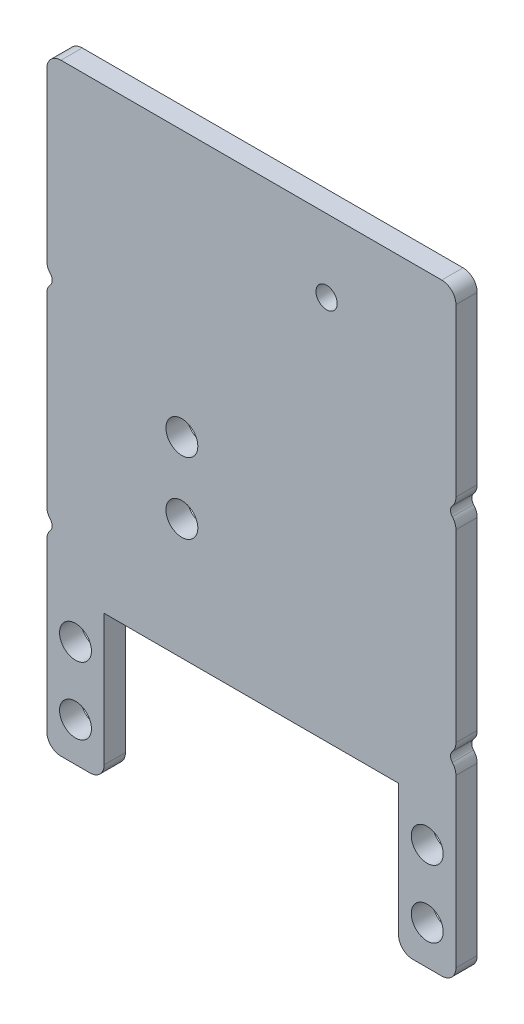
from build123d import *

# Parameters (mm, degrees)
SKETCH1_R           = 2.25
SKETCH1_R_2         = 1.5
BOSS_EXTRUDE1_DEPTH = 3


with BuildPart() as part:
    # Sketch1 → Boss-Extrude1 (new body)
    with BuildSketch(Plane.XY):
        with BuildLine():
            Line((-43.5, -20.5), (-47.6, -20.5))
            ThreePointArc((-47.6, -20.5), (-49.014213562, -19.914213562), (-49.6, -18.5))
            Line((-49.6, -18.5), (-49.6, 5))
            ThreePointArc((-49.6, 5), (-49.468344718, 5.71364418), (-49.090711985, 6.333333333))
            ThreePointArc((-49.090711985, 6.333333333), (-48.836067978, 7), (-49.090711985, 7.666666667))
            ThreePointArc((-49.090711985, 7.666666667), (-49.468344718, 8.28635582), (-49.6, 9))
            Line((-49.6, 9), (-49.6, 35))
            ThreePointArc((-49.6, 35), (-49.468344718, 35.71364418), (-49.090711985, 36.333333333))
            ThreePointArc((-49.090711985, 36.333333333), (-48.836067978, 37), (-49.090711985, 37.666666667))
            ThreePointArc((-49.090711985, 37.666666667), (-49.468344718, 38.28635582), (-49.6, 39))
            Line((-49.6, 39), (-49.6, 62.5))
            ThreePointArc((-49.6, 62.5), (-49.014213562, 63.914213562), (-47.6, 64.5))
            Line((-47.6, 64.5), (6.1, 64.5))
            ThreePointArc((6.1, 64.5), (7.514213562, 63.914213562), (8.1, 62.5))
            Line((8.1, 62.5), (8.1, 39))
            ThreePointArc((8.1, 39), (7.968344718, 38.28635582), (7.590711985, 37.666666667))
            ThreePointArc((7.590711985, 37.666666667), (7.336067978, 37), (7.590711985, 36.333333333))
            ThreePointArc((7.590711985, 36.333333333), (7.968344718, 35.71364418), (8.1, 35))
            Line((8.1, 35), (8.1, 9))
            ThreePointArc((8.1, 9), (7.968344718, 8.28635582), (7.590711985, 7.666666667))
            ThreePointArc((7.590711985, 7.666666667), (7.336067978, 7), (7.590711985, 6.333333333))
            ThreePointArc((7.590711985, 6.333333333), (7.968344718, 5.71364418), (8.1, 5))
            Line((8.1, 5), (8.1, -18.5))
            ThreePointArc((8.1, -18.5), (7.514213562, -19.914213562), (6.1, -20.5))
            Line((6.1, -20.5), (2, -20.5))
            ThreePointArc((2, -20.5), (0.585786438, -19.914213562), (0, -18.5))
            Line((0, -18.5), (0, 0))
            Line((0, 0), (-41.5, 0))
            Line((-41.5, 0), (-41.5, -18.5))
            ThreePointArc((-41.5, -18.5), (-42.085786438, -19.914213562), (-43.5, -20.5))
        make_face()
        with Locations((-45.55, -5.5)):
            Circle(SKETCH1_R, mode=Mode.SUBTRACT)
        with Locations((-45.55, -15)):
            Circle(SKETCH1_R, mode=Mode.SUBTRACT)
        with Locations((4.05, -5.5)):
            Circle(SKETCH1_R, mode=Mode.SUBTRACT)
        with Locations((4.05, -15)):
            Circle(SKETCH1_R, mode=Mode.SUBTRACT)
        with Locations((-30.55, 17)):
            Circle(SKETCH1_R, mode=Mode.SUBTRACT)
        with Locations((-30.55, 27)):
            Circle(SKETCH1_R, mode=Mode.SUBTRACT)
        with Locations((-10.14, 54.25)):
            Circle(SKETCH1_R_2, mode=Mode.SUBTRACT)
    extrude(amount=BOSS_EXTRUDE1_DEPTH)


solid = part.part
